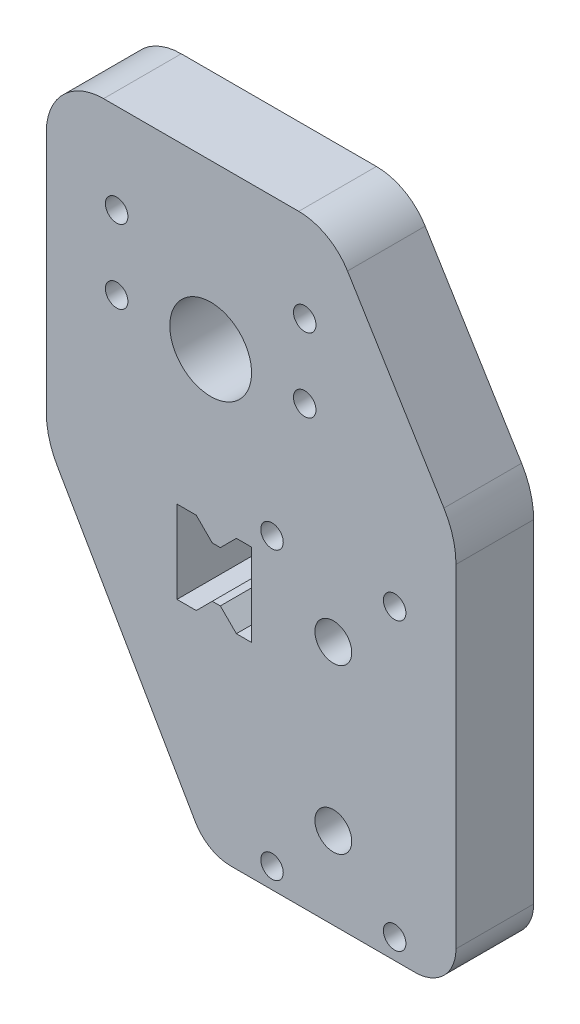
from build123d import *

# Parameters (mm, degrees)
BOSS_EXTRUDE1_DEPTH  = 19
FILLET1_R            = 10
M5_CLEARANCE_HOLE2_D = 5.5
M5_CLEARANCE_HOLE1_D = 5.5
FILLET2_R            = 4
BOSS_EXTRUDE2_DEPTH  = 19
M8_CLEARANCE_HOLE1_D = 9
CUT_EXTRUDE2_DEPTH   = 4
SKETCH16_R           = 10
CUT_EXTRUDE3_DEPTH   = 5
CUT_EXTRUDE4_DEPTH   = 20
SKETCH19_R           = 10
CUT_EXTRUDE5_DEPTH   = 20


with BuildPart() as part:
    # Sketch1 → Boss-Extrude1 (new body)
    with BuildSketch(Plane.XY):
        with BuildLine():
            Line((-170.200000001, 540.824594888), (-129.309401077, 470))
            Line((-129.309401077, 470), (-93, 470))
            ThreePointArc((-93, 470), (-90.878679656, 470.878679656), (-90, 473))
            Line((-90, 473), (-90, 564.25527297))
            Line((-90, 564.25527297), (-116.225329238, 607))
            Line((-116.225329238, 607), (-170.200000001, 607))
            Line((-170.200000001, 607), (-170.200000001, 540.824594888))
        make_face()
    extrude(amount=BOSS_EXTRUDE1_DEPTH)

    # Fillet1
    fillet1_edges = [part.edges().sort_by_distance(p)[0] for p in [
        (-90, 564.25527297, 9.5),
        (-129.309401077, 470, 9.5),
        (-170.200000001, 540.824594888, 9.5),
    ]]
    fillet(fillet1_edges, radius=FILLET1_R)

    # M5 Clearance Hole2 (through all)
    with Locations(Plane(origin=(0, 0, 0), x_dir=(-1, 0, 0), z_dir=(0, 0, -1))):
        with Locations((117.000000001, 595), (117.000000001, 577), (163.000000001, 577), (163.000000001, 595)):
            Hole(M5_CLEARANCE_HOLE2_D / 2)

    # M5 Clearance Hole1 (through all)
    with Locations(Plane.XY.offset(19)):
        with Locations((-95, 545), (-125, 545), (-125, 475), (-95, 475), (-110, 490), (-110, 530)):
            Hole(M5_CLEARANCE_HOLE1_D / 2)

    # Fillet2
    fillet2_edges = [part.edges().sort_by_distance(p)[0] for p in [
        (-116.225329238, 607, 9.5),
        (-170.200000001, 607, 9.5),
    ]]
    fillet(fillet2_edges, radius=FILLET2_R)

    # Sketch11 → Boss-Extrude2 (add)
    with BuildSketch(Plane.XY.offset(19)):
        with BuildLine():
            ThreePointArc((-143.743157806, 475), (-140.082903769, 471.339745962), (-135.082903769, 470))
            Line((-135.082903769, 470), (-123.535898385, 470))
            ThreePointArc((-123.535898385, 470), (-128.535898385, 471.339745962), (-132.196152423, 475))
            Line((-132.196152423, 475), (-168.860254039, 538.504086813))
            ThreePointArc((-168.860254039, 538.504086813), (-169.859258264, 540.915896362), (-170.200000001, 543.504086813))
            Line((-170.200000001, 543.504086813), (-170.200000001, 603))
            ThreePointArc((-170.200000001, 603), (-169.028427125, 605.828427125), (-166.200000001, 607))
            Line((-166.200000001, 607), (-118.464037729, 607))
            ThreePointArc((-118.464037729, 607), (-116.510482263, 606.490504411), (-115.054590744, 605.091810521))
            Line((-115.054590744, 605.091810521), (-91.476382537, 566.661632408))
            ThreePointArc((-91.476382537, 566.661632408), (-90.37617086, 564.149073659), (-90, 561.432106106))
            Line((-90, 561.432106106), (-90, 473))
            ThreePointArc((-90, 473), (-90.878679656, 470.878679656), (-93, 470))
            Line((-93, 470), (-90, 470))
            ThreePointArc((-90, 470), (-82.928932188, 472.928932188), (-80, 480))
            Line((-80, 480), (-80, 561.432106106))
            ThreePointArc((-80, 561.432106106), (-80.75234172, 566.866041212), (-82.952765074, 571.89115871))
            Line((-82.952765074, 571.89115871), (-106.530973281, 610.321336823))
            ThreePointArc((-106.530973281, 610.321336823), (-111.626593598, 615.216765438), (-118.464037729, 617))
            Line((-118.464037729, 617), (-166.200000001, 617))
            ThreePointArc((-166.200000001, 617), (-176.099494937, 612.899494937), (-180.200000001, 603))
            Line((-180.200000001, 603), (-180.200000001, 543.504086813))
            ThreePointArc((-180.200000001, 543.504086813), (-179.518516526, 538.327705911), (-177.520508076, 533.504086813))
            Line((-177.520508076, 533.504086813), (-143.743157806, 475))
        make_face()
    extrude(amount=-BOSS_EXTRUDE2_DEPTH)

    # M8 Clearance Hole1 (through all)
    with Locations(Plane.XY.offset(19)):
        with Locations((-110, 530), (-110, 490)):
            Hole(M8_CLEARANCE_HOLE1_D / 2)

    # Sketch15 → Cut-Extrude2 (cut)
    with BuildSketch(Plane.XY):
        Polygon((-166.960000001, 579.286307066), (-166.960000001, 574.713692934), (-163.000000001, 572.427385868), (-159.040000001, 574.713692934), (-159.040000001, 579.286307066), (-163.000000001, 581.572614132), align=None)
        Polygon((-120.960000001, 579.286307066), (-120.960000001, 574.713692934), (-117.000000001, 572.427385868), (-113.040000001, 574.713692934), (-113.040000001, 579.286307066), (-117.000000001, 581.572614132), align=None)
        Polygon((-113.040000001, 592.713692934), (-117.000000001, 590.427385868), (-120.960000001, 592.713692934), (-120.960000001, 597.286307066), (-117.000000001, 599.572614132), (-113.040000001, 597.286307066), align=None)
        Polygon((-163.000000001, 590.427385868), (-166.960000001, 592.713692934), (-166.960000001, 597.286307066), (-163.000000001, 599.572614132), (-159.040000001, 597.286307066), (-159.040000001, 592.713692934), align=None)
    extrude(amount=CUT_EXTRUDE2_DEPTH, mode=Mode.SUBTRACT)

    # Sketch16 → Cut-Extrude3 (cut)
    with BuildSketch(Plane(origin=(0, 0, 19), x_dir=(-1, 0, 0), z_dir=(0, 0, -1))):
        with Locations((140.000000001, 577)):
            Circle(SKETCH16_R)
    extrude(amount=CUT_EXTRUDE3_DEPTH, mode=Mode.SUBTRACT)

    # Sketch18 → Cut-Extrude4 (cut)
    with BuildSketch(Plane.XY.offset(19)):
        Polygon((-130, 540.1), (-133.716421356, 540.1), (-137.641421356, 536.175), (-139.608578644, 536.175), (-143.533578644, 540.1), (-148.25, 540.1), (-148.25, 519.9), (-143.533578644, 519.9), (-139.608578644, 523.825), (-137.641421356, 523.825), (-133.716421356, 519.9), (-130, 519.9), align=None)
    extrude(amount=-CUT_EXTRUDE4_DEPTH, mode=Mode.SUBTRACT)

    # Sketch19 → Cut-Extrude5 (cut)
    with BuildSketch(Plane.XY.offset(14)):
        with Locations(Location((-140.000000001, 577, 0), (0, 0, 180.000000002))):
            Circle(SKETCH19_R)
    extrude(amount=-CUT_EXTRUDE5_DEPTH, mode=Mode.SUBTRACT)


solid = part.part
